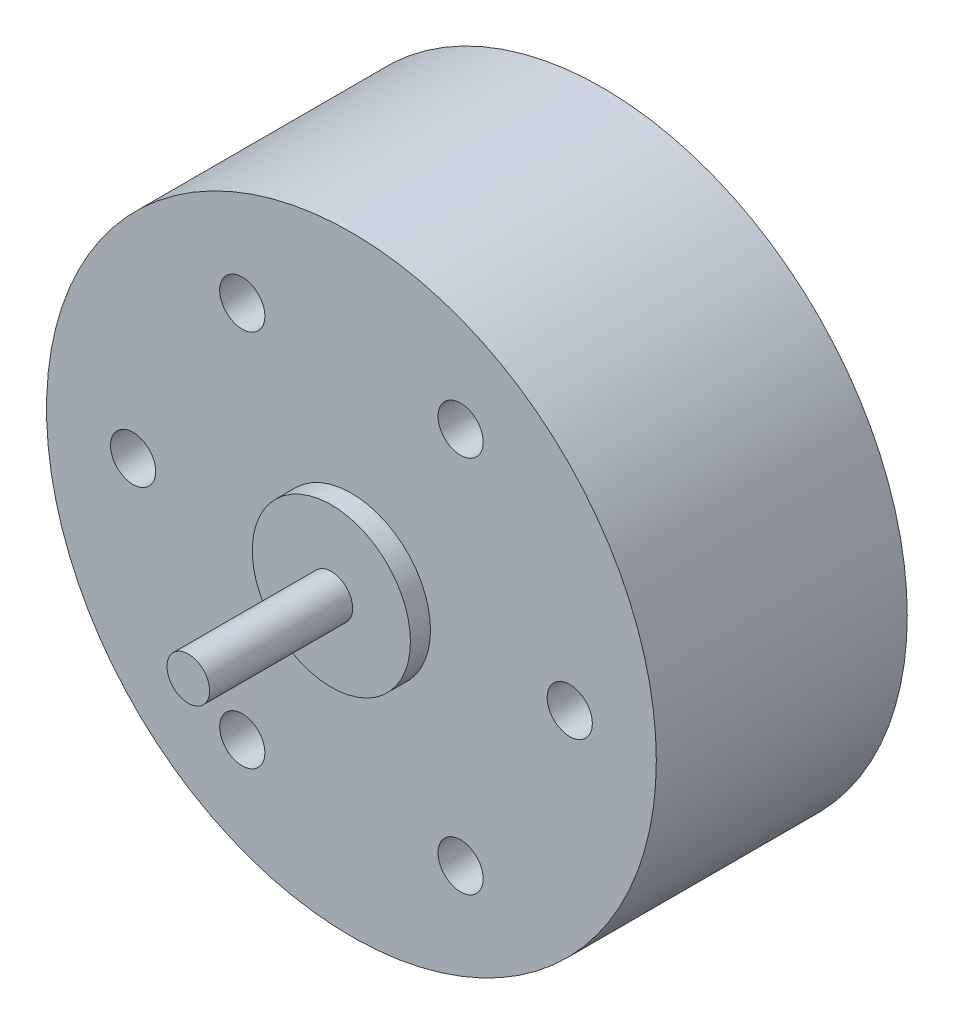
from build123d import *

# Parameters (mm, degrees)
SKETCH1_R                  = 12.15
BOSS_EXTRUDE1_DEPTH        = 10
SKETCH2_R                  = 3.15
BOSS_EXTRUDE2_DEPTH        = 0.8
SKETCH3_R                  = 0.85
BOSS_EXTRUDE3_DEPTH        = 5.7
M1_6_CLEARANCE_HOLE1_D     = 1.8
M1_6_CLEARANCE_HOLE1_DEPTH = 3
M1_6_CLEARANCE_HOLE1_TIP   = 0.540774557


with BuildPart() as part:
    # Sketch1 → Boss-Extrude1 (new body)
    with BuildSketch(Plane.XY):
        Circle(SKETCH1_R)
    extrude(amount=BOSS_EXTRUDE1_DEPTH)

    # Sketch2 → Boss-Extrude2 (add)
    with BuildSketch(Plane.XY.offset(10)):
        Circle(SKETCH2_R)
    extrude(amount=BOSS_EXTRUDE2_DEPTH)

    # Sketch3 → Boss-Extrude3 (add)
    with BuildSketch(Plane.XY.offset(10.8)):
        Circle(SKETCH3_R)
    extrude(amount=BOSS_EXTRUDE3_DEPTH)

    # M1.6 Clearance Hole1
    with Locations(Plane.XY.offset(10)):
        with Locations((-4.35, 7.534421013), (4.35, 7.534421013), (8.7, 0), (4.35, -7.534421013), (-4.35, -7.534421013), (-8.7, 0)):
            Hole(M1_6_CLEARANCE_HOLE1_D / 2, depth=M1_6_CLEARANCE_HOLE1_DEPTH)
            with Locations((0, 0, -(M1_6_CLEARANCE_HOLE1_DEPTH + M1_6_CLEARANCE_HOLE1_TIP / 2))):  # 118° drill point
                Cone(0, M1_6_CLEARANCE_HOLE1_D / 2, M1_6_CLEARANCE_HOLE1_TIP, mode=Mode.SUBTRACT)


solid = part.part
